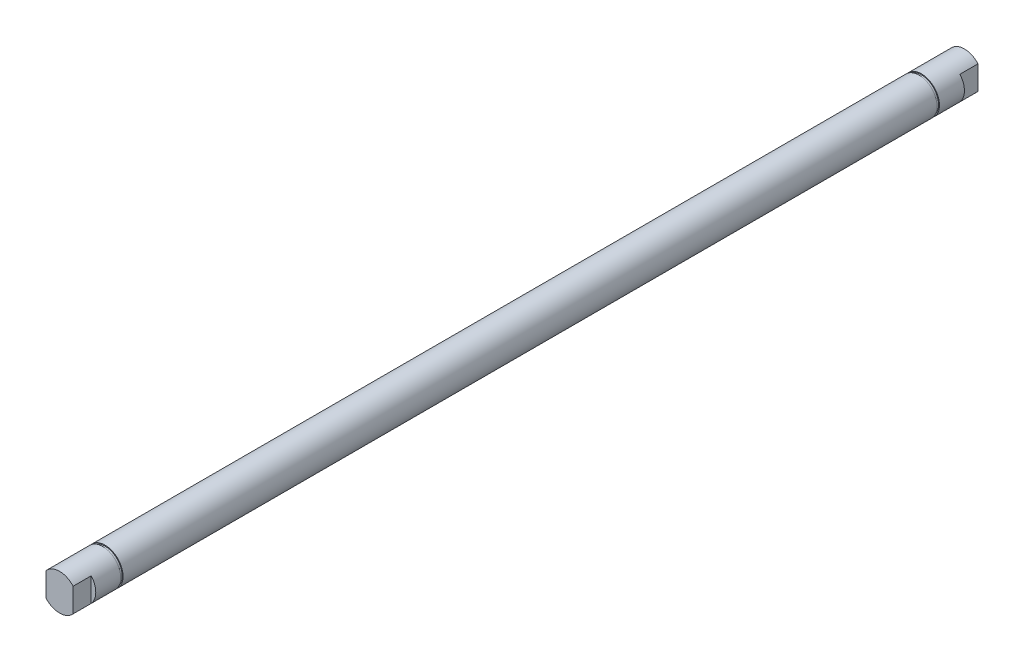
from build123d import *

# Parameters (mm, degrees)
SKETCH_1_R           = 10
EXTRUDE_1_DEPTH      = 250
SKETCH_3_W           = 1.3
SKETCH_3_H           = 0.5
SKETCH_4_OUTSIDE_W   = 122.16
SKETCH_4_OUTSIDE_H   = 122.16
SKETCH_4_OUTSIDE_W_2 = 15
SKETCH_4_OUTSIDE_H_2 = 51.001115416
CUT_EXTRUDE_1_DEPTH  = 10


with BuildPart() as part:
    # 草图1 → 凸台-拉伸1 (new, symmetric)
    with BuildSketch(Plane.XY):
        Circle(SKETCH_1_R)
    extrude(amount=EXTRUDE_1_DEPTH, both=True)

    # 草图3 → 切除-旋转1 (revolve, cut)
    with BuildSketch(Plane(origin=(100, 0, 250), x_dir=(0, 0, -1), z_dir=(0, 1, 0))):
        with Locations((24.45, 90.25)):
            Rectangle(SKETCH_3_W, SKETCH_3_H)
    cut_revolve_1 = revolve(axis=Axis((0, 0, 250), (0, 0, -1)), mode=Mode.SUBTRACT)

    # 草图4 outside → 切除-拉伸1 (cut)
    with BuildSketch(Plane(origin=(0, 0, -250), x_dir=(-1, 0, 0), z_dir=(0, 0, -1))):
        Rectangle(SKETCH_4_OUTSIDE_W, SKETCH_4_OUTSIDE_H)
        Rectangle(SKETCH_4_OUTSIDE_W_2, SKETCH_4_OUTSIDE_H_2, mode=Mode.SUBTRACT)
    cut_extrude_1 = extrude(amount=-CUT_EXTRUDE_1_DEPTH, mode=Mode.SUBTRACT)

    # 镜向1: 切除-旋转1, 切除-拉伸1 across plane
    add(cut_revolve_1.mirror(Plane.XY), mode=Mode.SUBTRACT)
    add(cut_extrude_1.mirror(Plane.XY), mode=Mode.SUBTRACT)


solid = part.part
